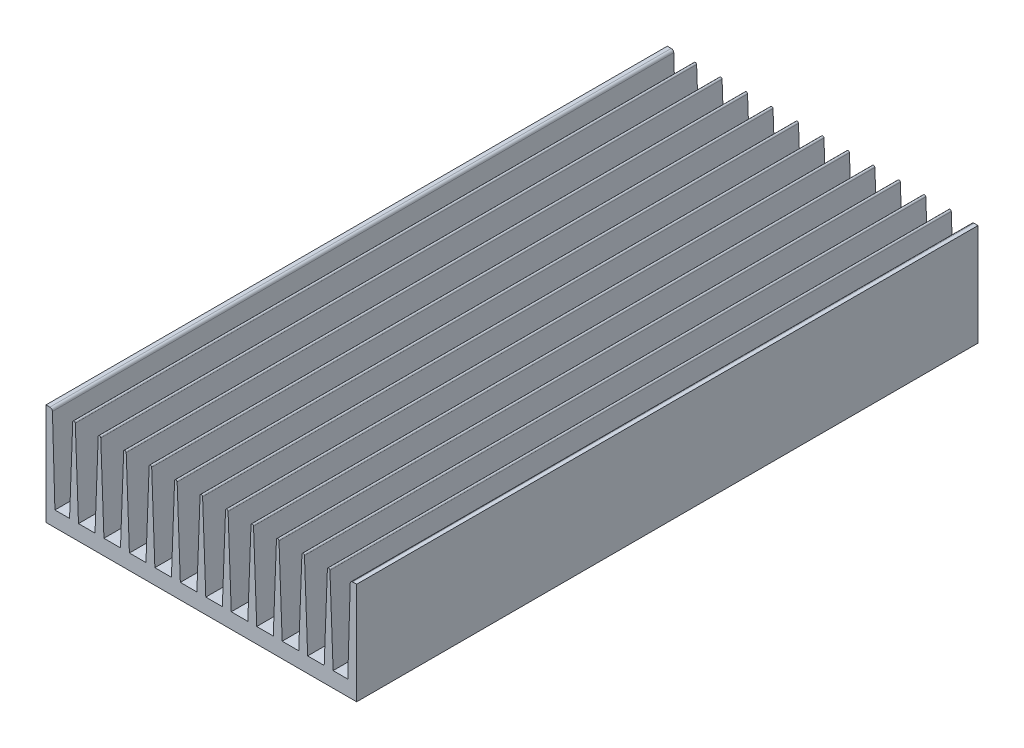
from build123d import *

# Parameters (mm, degrees)
EXTRUDE_1_DEPTH       = 244
EXTRUDE_3_DEPTH       = 244
PATTERN_CURVE_1_COUNT = 11
PATTERN_CURVE_1_PITCH = 10
SKETCH_3_R            = 2.25
CUT_EXTRUDE_1_DEPTH   = 6
SKETCH_4_R            = 1.6
SKETCH_4_R_2          = 2.6
SKETCH_4_R_3          = 2.1
CUT_EXTRUDE_2_DEPTH   = 5.5


with BuildPart() as part:
    # Эскиз1 → Вытянуть1 (new body)
    with BuildSketch(Plane.XY):
        with BuildLine():
            Line((0, 40), (1.528979332, 40))
            ThreePointArc((1.528979332, 40), (2.225614441, 39.717425624), (2.528547087, 39.029399052))
            Line((2.528547087, 39.029399052), (3.5, 6))
            Line((3.5, 6), (118.5, 6))
            Line((118.5, 6), (119.471452913, 39.029399052))
            ThreePointArc((119.471452913, 39.029399052), (119.774385559, 39.717425624), (120.471020668, 40))
            Line((120.471020668, 40), (122, 40))
            Line((122, 40), (122, 0))
            Line((122, 0), (0, 0))
            Line((0, 0), (0, 40))
        make_face()
    extrude(amount=EXTRUDE_1_DEPTH)

    # Эскиз2 → Вытянуть3 (add)
    with BuildSketch(Plane.XY.offset(244)):
        with BuildLine():
            Line((10.5, 39.5), (9.25, 6))
            Line((9.25, 6), (12.75, 6))
            Line((12.75, 6), (11.5, 39.5))
            ThreePointArc((11.5, 39.5), (11, 40), (10.5, 39.5))
        make_face()
    extrude_3 = extrude(amount=-EXTRUDE_3_DEPTH)

    # Кривая1: Вытянуть3 ×11
    with Locations(*[(i * PATTERN_CURVE_1_PITCH, 0, 0) for i in range(1, PATTERN_CURVE_1_COUNT)]):
        add(extrude_3)

    # Эскиз3 → Вырез-Вытянуть1 (cut)
    with BuildSketch(Plane.XZ):
        with Locations((26, 236)):
            Circle(SKETCH_3_R)
        with Locations((96, 236)):
            Circle(SKETCH_3_R)
        with Locations(Location((96, 8, 0), (0, 0, 180))):
            Circle(SKETCH_3_R)
        with Locations(Location((26, 8, 0), (0, 0, 180))):
            Circle(SKETCH_3_R)
    extrude(amount=-CUT_EXTRUDE_1_DEPTH, mode=Mode.SUBTRACT)

    # Эскиз4 → Вырез-Вытянуть2 (cut)
    with BuildSketch(Plane(origin=(-5.723570629, 0, -26.359021189), x_dir=(1, 0, 0), z_dir=(0, -1, 0))):
        with Locations((55.723570629, 158.359021189)):
            Circle(SKETCH_4_R)
        with Locations((55.723570629, 53.359021189)):
            Circle(SKETCH_4_R)
        with Locations((55.723570629, 173.359021189)):
            Circle(SKETCH_4_R)
        with Locations((73.723570629, 86.359021189)):
            Circle(SKETCH_4_R)
        with Locations((73.723570629, 134.359021189)):
            Circle(SKETCH_4_R)
        with Locations((84.723570629, 110.359021189)):
            Circle(SKETCH_4_R_2)
        with Locations((17.723570629, 220.359021189)):
            Circle(SKETCH_4_R_3)
    extrude(amount=-CUT_EXTRUDE_2_DEPTH, mode=Mode.SUBTRACT)


solid = part.part
